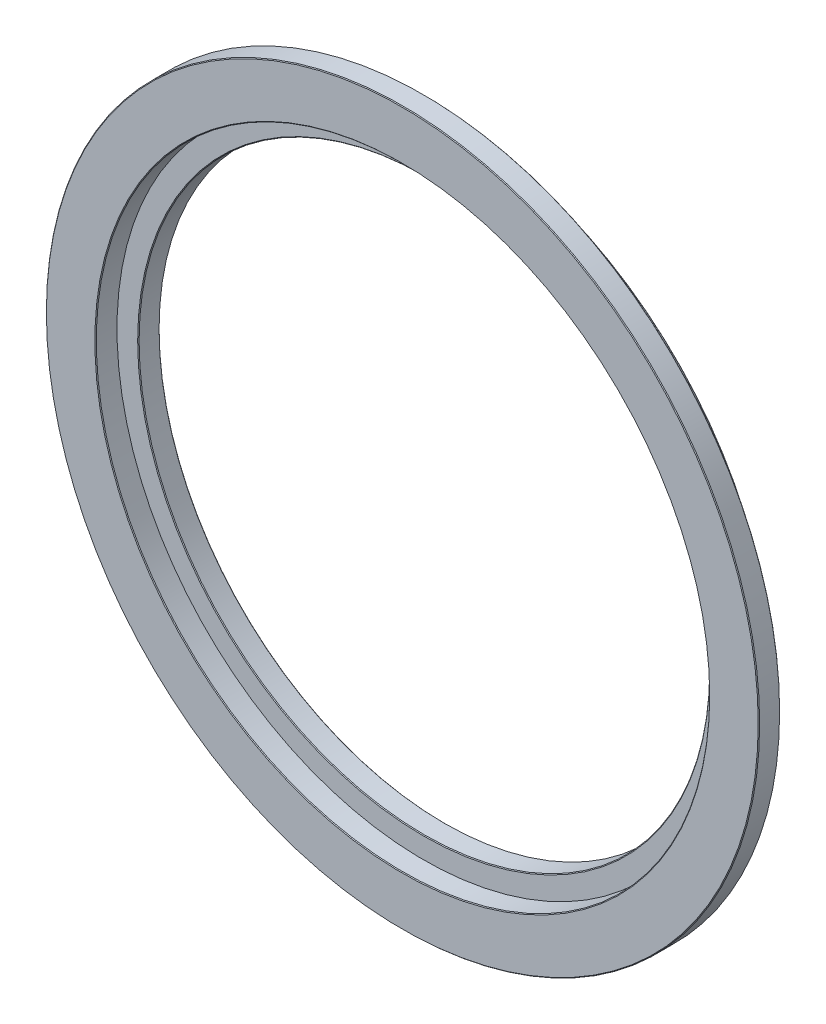
from build123d import *


with BuildPart() as part:
    # Sketch1 → Revolve1 (revolve)
    with BuildSketch(Plane(origin=(0, 0, 0), x_dir=(0, 0, -1), z_dir=(1, 0, 0)), mode=Mode.PRIVATE) as revolve1_sk:
        Polygon((-0.1, 40), (-2.9, 40), (-3, 40.1), (-3, 43), (-5.9, 43), (-6, 43.1), (-6, 49.9), (-5.9, 50), (-3.1, 50), (-3, 49.9), (-3, 46), (-0.1, 46), (0, 45.9), (0, 40.1), align=None)
    revolve(revolve1_sk.sketch.rotate(Axis((0, 0, 60.832049307), (0, 0, -1)), 90), axis=Axis((0, 0, 60.832049307), (0, 0, -1)))


solid = part.part
